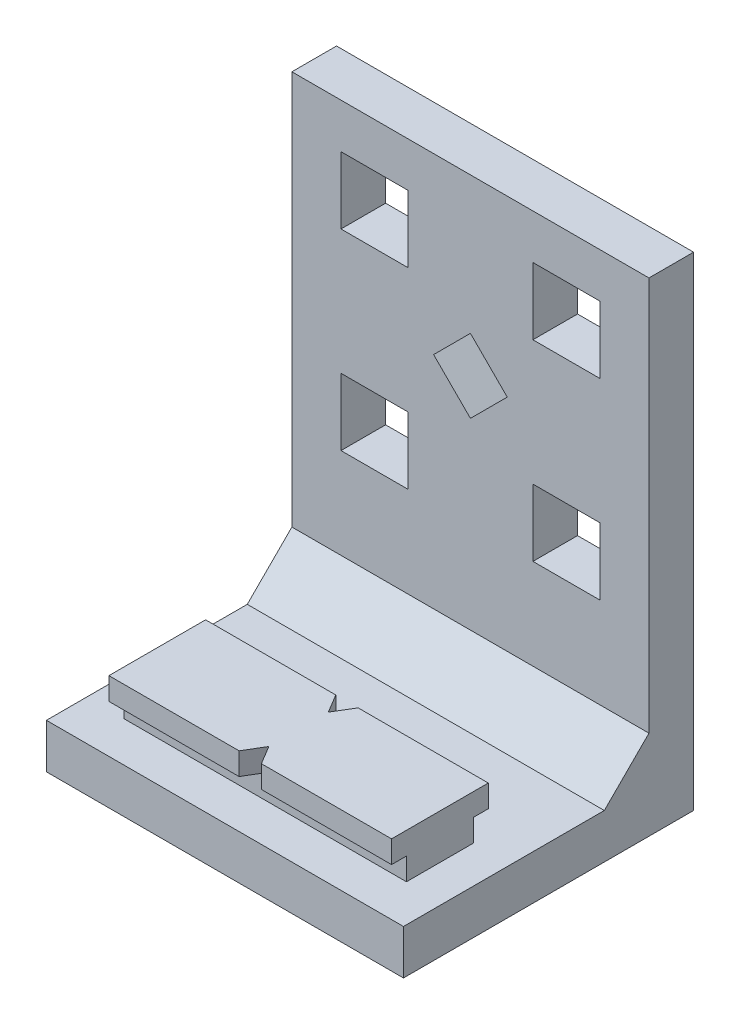
from build123d import *

# Parameters (mm, degrees)
SKETCH1_W           = 24
SKETCH1_H           = 19.5
BOSS_EXTRUDE1_DEPTH = 3
SKETCH3_W           = 19
SKETCH3_H           = 4.5
BOSS_EXTRUDE2_DEPTH = 1.5
SKETCH4_W           = 19
SKETCH4_H           = 6.5
BOSS_EXTRUDE3_DEPTH = 1.5
CUT_EXTRUDE1_DEPTH  = 1.5
SKETCH6_W           = 24
SKETCH6_H           = 3
BOSS_EXTRUDE4_DEPTH = 29.5
SKETCH7_W           = 4.5
SKETCH7_H           = 4.5
CUT_EXTRUDE2_DEPTH  = 39.373167709
CHAMFER1_SIZE       = 3


with BuildPart() as part:
    # Sketch1 → Boss-Extrude1 (new body)
    with BuildSketch(Plane(origin=(0, 0, 0), x_dir=(1, 0, 0), z_dir=(0, 1, 0))):
        Rectangle(SKETCH1_W, SKETCH1_H)
    extrude(amount=BOSS_EXTRUDE1_DEPTH)

    # Sketch3 → Boss-Extrude2 (add)
    with BuildSketch(Plane(origin=(0, 3, 0), x_dir=(1, 0, 0), z_dir=(0, 1, 0))):
        with Locations((0, -4.8)):
            Rectangle(SKETCH3_W, SKETCH3_H)
    extrude(amount=BOSS_EXTRUDE2_DEPTH)

    # Sketch4 → Boss-Extrude3 (add)
    with BuildSketch(Plane(origin=(0, 4.5, 0), x_dir=(1, 0, 0), z_dir=(0, 1, 0))):
        with Locations((0, -4.8)):
            Rectangle(SKETCH4_W, SKETCH4_H)
    extrude(amount=BOSS_EXTRUDE3_DEPTH)

    # Sketch5 → Cut-Extrude1 (cut)
    with BuildSketch(Plane(origin=(0, 6, 0), x_dir=(1, 0, 0), z_dir=(0, 1, 0))):
        Polygon((0, -2.8), (0.75, -1.55), (-0.75, -1.55), align=None)
        Polygon((0, -6.8), (0.75, -8.05), (-0.75, -8.05), align=None)
    extrude(amount=-CUT_EXTRUDE1_DEPTH, mode=Mode.SUBTRACT)

    # Sketch6 → Boss-Extrude4 (add)
    with BuildSketch(Plane(origin=(0, 3, 0), x_dir=(1, 0, 0), z_dir=(0, 1, 0))):
        with Locations((0, 8.25)):
            Rectangle(SKETCH6_W, SKETCH6_H)
    extrude(amount=BOSS_EXTRUDE4_DEPTH)

    # Sketch7 → Cut-Extrude2 (cut, through all)
    with BuildSketch(Plane.XY.offset(-6.75)):
        with Locations((-6.45, 27.25)):
            Rectangle(SKETCH7_W, SKETCH7_H)
        with Locations((-6.45, 14.35)):
            Rectangle(SKETCH7_W, SKETCH7_H)
        with Locations((6.45, 14.35)):
            Rectangle(SKETCH7_W, SKETCH7_H)
        with Locations((6.45, 27.25)):
            Rectangle(SKETCH7_W, SKETCH7_H)
        Polygon((-2.474873734, 20.8), (0, 23.274873734), (2.474873734, 20.8), (0, 18.325126266), align=None)
    extrude(amount=-CUT_EXTRUDE2_DEPTH, mode=Mode.SUBTRACT)

    # Chamfer1
    chamfer1_edges = [part.edges().sort_by_distance(p)[0] for p in [
        (0, 3, -6.75),
    ]]
    chamfer(chamfer1_edges, length=CHAMFER1_SIZE)


solid = part.part
